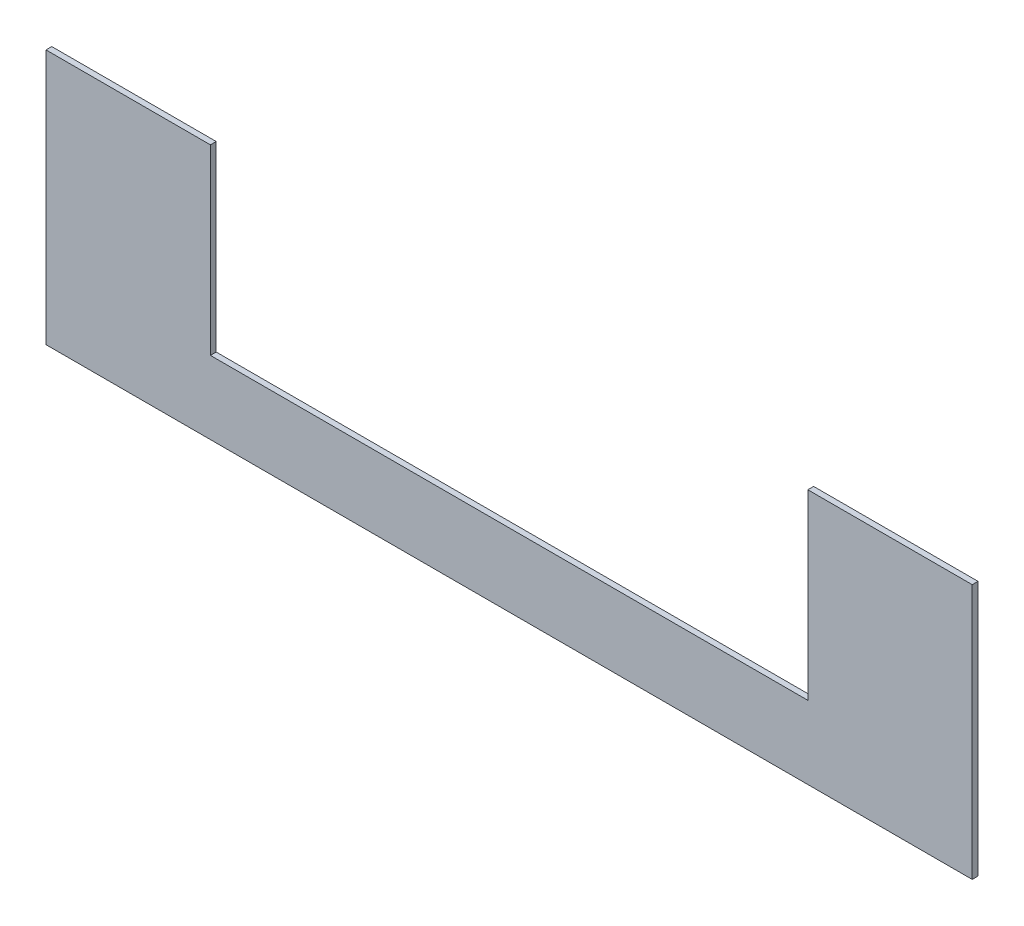
from build123d import *

# Parameters (mm, degrees)
BOSS_EXTRUDE1_DEPTH = 0.01


with BuildPart() as part:
    # Sketch1 → Boss-Extrude1 (new body)
    with BuildSketch(Plane.XY):
        Polygon((0.681886765, 0.040069963), (0.681886765, -0.400930037), (-0.918113235, -0.400930037), (-0.918113235, 0.040069963), (-0.634113235, 0.040069963), (-0.634113235, -0.274930037), (0.397886765, -0.274930037), (0.397886765, 0.040069963), align=None)
    extrude(amount=BOSS_EXTRUDE1_DEPTH)


solid = part.part
